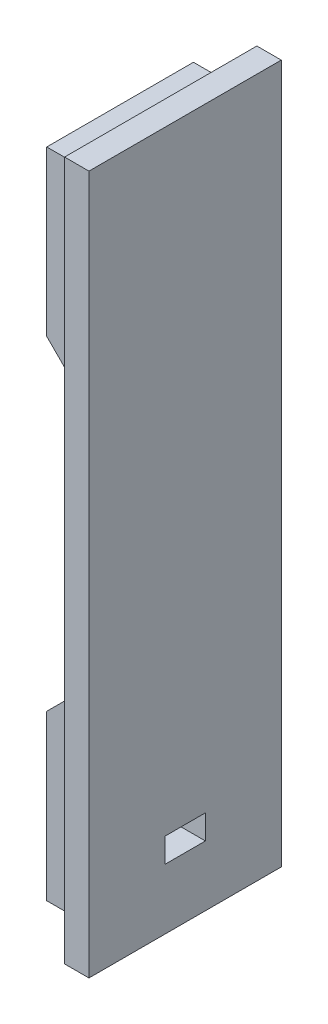
from build123d import *

# Parameters (mm, degrees)
SKETCH1_W               = 23.666666666
SKETCH1_H               = 86
BOSS_EXTRUDE1_DEPTH     = 3
SKETCH2_W               = 5
SKETCH2_H               = 3
CUT_EXTRUDE1_DEPTH      = 45.699303997
SKETCH3_W               = 18.054262684
SKETCH3_H               = 80.34146894
BOSS_EXTRUDE2_DEPTH     = 5
SKETCH5_W               = 11.91581337
SKETCH5_H               = 76.008445896
CUT_EXTRUDE2_DEPTH      = 5
CUT_EXTRUDE3_DEPTH      = 45.877920827
CUT_EXTRUDE3_DEPTH_BACK = 45.877920827
SKETCH7_W               = 2
SKETCH7_H               = 9
BOSS_EXTRUDE3_DEPTH     = 5
CUT_EXTRUDE4_DEPTH      = 5
SKETCH9_W               = 2.534423144
SKETCH9_H               = 2
CUT_EXTRUDE5_DEPTH      = 1
CUT_EXTRUDE6_DEPTH      = 2
BOSS_EXTRUDE5_DEPTH     = 2
BOSS_EXTRUDE6_DEPTH     = 2
CUT_EXTRUDE7_START      = -2
CUT_EXTRUDE7_DEPTH      = 2


with BuildPart() as part:
    # Sketch1 → Boss-Extrude1 (new body)
    with BuildSketch(Plane(origin=(0, 0, 0), x_dir=(0, 0, -1), z_dir=(1, 0, 0))):
        Rectangle(SKETCH1_W, SKETCH1_H)
    extrude(amount=BOSS_EXTRUDE1_DEPTH)

    # Sketch2 → Cut-Extrude1 (cut, through all)
    with BuildSketch(Plane(origin=(3, 0, 0), x_dir=(0, 0, -1), z_dir=(1, 0, 0))):
        with Locations((0, -34.060962647)):
            Rectangle(SKETCH2_W, SKETCH2_H)
    extrude(amount=-CUT_EXTRUDE1_DEPTH, mode=Mode.SUBTRACT)

    # Sketch3 → Boss-Extrude2 (add)
    with BuildSketch(Plane.ZY):
        Rectangle(SKETCH3_W, SKETCH3_H)
    extrude(amount=BOSS_EXTRUDE2_DEPTH)

    # Sketch5 → Cut-Extrude2 (cut)
    with BuildSketch(Plane.ZY.offset(5)):
        Rectangle(SKETCH5_W, SKETCH5_H)
    extrude(amount=-CUT_EXTRUDE2_DEPTH, mode=Mode.SUBTRACT)

    # Sketch6 → Cut-Extrude3 (cut, two sides: drawn at the far end of the back side and taken through both)
    with BuildSketch(Plane.XY.offset(-CUT_EXTRUDE3_DEPTH_BACK)):
        Polygon((-5, -19.974207963), (-1.714874455, -16.689082418), (-1.714874455, 16.689082418), (-5, 19.974207963), align=None)
    extrude(amount=CUT_EXTRUDE3_DEPTH + CUT_EXTRUDE3_DEPTH_BACK, mode=Mode.SUBTRACT)

    # Sketch7 → Boss-Extrude3 (add)
    with BuildSketch(Plane.ZY):
        Rectangle(SKETCH7_W, SKETCH7_H)
    extrude(amount=BOSS_EXTRUDE3_DEPTH)

    # Sketch8 → Cut-Extrude4 (cut)
    with BuildSketch(Plane.XY.offset(1)):
        with BuildLine():
            ThreePointArc((-5, -0.459578833), (-2.44210099, -2.530530169), (0, -0.32421434))
            Line((0, -0.32421434), (0, 0.32421434))
            ThreePointArc((0, 0.32421434), (-2.44210099, 2.530530169), (-5, 0.459578833))
            Line((-5, 0.459578833), (-5, -0.459578833))
        make_face()
        with BuildLine():
            Line((-5, -4.5), (-2.510609776, -4.5))
            ThreePointArc((-2.510609776, -4.5), (-3.81075192, -4.308088951), (-5, -3.748724625))
            Line((-5, -3.748724625), (-5, -4.5))
        make_face()
        with BuildLine():
            Line((-2.510609776, -4.5), (0, -4.5))
            Line((0, -4.5), (0, -3.734546632))
            ThreePointArc((0, -3.734546632), (-1.198256898, -4.304384965), (-2.510609776, -4.5))
        make_face()
        with BuildLine():
            ThreePointArc((-2.510609794, 4.5), (-1.198256907, 4.304384967), (0, 3.734546632))
            Line((0, 3.734546632), (0, 4.5))
            Line((0, 4.5), (-2.510609794, 4.5))
        make_face()
        with BuildLine():
            ThreePointArc((-5, 3.748724625), (-3.810751929, 4.308088948), (-2.510609794, 4.5))
            Line((-2.510609794, 4.5), (-5, 4.5))
            Line((-5, 4.5), (-5, 3.748724625))
        make_face()
    extrude(amount=-CUT_EXTRUDE4_DEPTH, mode=Mode.SUBTRACT)

    # Sketch9 → Cut-Extrude5 (cut)
    with BuildSketch(Plane.ZY.offset(5)):
        Rectangle(SKETCH9_W, SKETCH9_H)
    extrude(amount=-CUT_EXTRUDE5_DEPTH, mode=Mode.SUBTRACT)

    # Sketch12 → Cut-Extrude6 (cut)
    with BuildSketch(Plane.XY.offset(1)):
        with BuildLine():
            Line((-4.836179898, -1), (-5, -1))
            Line((-5, -1), (-5, -3.748724625))
            ThreePointArc((-5, -3.748724625), (-2.497849634, -4.499981909), (0, -3.734546632))
            Line((0, -3.734546632), (0, -0.32421434))
            ThreePointArc((0, -0.32421434), (-2.160279243, -2.507098902), (-4.836179898, -1))
        make_face()
        with BuildLine():
            Line((-5, 3.748724625), (-5, 1))
            Line((-5, 1), (-4.836179898, 1))
            ThreePointArc((-4.836179898, 1), (-2.160279243, 2.507098902), (0, 0.32421434))
            Line((0, 0.32421434), (0, 3.734546632))
            ThreePointArc((0, 3.734546632), (-2.497849634, 4.499981909), (-5, 3.748724625))
        make_face()
    extrude(amount=-CUT_EXTRUDE6_DEPTH, mode=Mode.SUBTRACT)

    # Sketch10 → Boss-Extrude5 (add)
    with BuildSketch(Plane.XY.offset(1)):
        with BuildLine():
            Line((0.632034053, -1.144834058), (-0.193, -4.453864907))
            ThreePointArc((-0.193, -4.453864907), (-2.801828378, -4.592278965), (-5.047908598, -3.258012274))
            Line((-5.047908598, -3.258012274), (-4.41989103, -0.739171385))
            Line((-4.41989103, -0.739171385), (-4.335953587, -0.66680401))
            ThreePointArc((-4.335953587, -0.66680401), (-2.053682052, -3.002243354), (0.632034053, -1.144834058))
        make_face()
        with BuildLine():
            Line((-5.047908598, 3.258012274), (-4.41989103, 0.739171385))
            Line((-4.41989103, 0.739171385), (-4.335953587, 0.66680401))
            ThreePointArc((-4.335953587, 0.66680401), (-2.053682052, 3.002243354), (0.632034053, 1.144834058))
            Line((0.632034053, 1.144834058), (-0.193, 4.453864907))
            ThreePointArc((-0.193, 4.453864907), (-2.801828378, 4.592278965), (-5.047908598, 3.258012274))
        make_face()
    extrude(amount=-BOSS_EXTRUDE5_DEPTH)

    # Sketch13 → Boss-Extrude6 (add)
    with BuildSketch(Plane(origin=(0, 0, -1), x_dir=(-1, 0, 0), z_dir=(0, 0, -1))):
        Polygon((0, 3.679784186), (0.193, 4.453864907), (-0.617433114, 4.244828064), (-0.739085506, -4.079345447), (0.193, -4.453864907), (0, -3.679784186), (0, -2.250971384), (0, 2.250971384), align=None)
    extrude(amount=-BOSS_EXTRUDE6_DEPTH)

    # Sketch15 → Cut-Extrude7 (cut)
    with BuildSketch(Plane(origin=(0, 0, -1), x_dir=(-1, 0, 0), z_dir=(0, 0, -1)).offset(CUT_EXTRUDE7_START)):
        Polygon((4.65583066, 1.685473556), (5.047908598, 3.258012274), (4.038538563, 1.685473556), align=None)
        with BuildLine():
            Line((4.65583066, 1.685473556), (4.038538563, 1.685473556))
            ThreePointArc((4.038538563, 1.685473556), (4.241224486, 1.191898546), (4.335953587, 0.66680401))
            Line((4.335953587, 0.66680401), (4.41989103, 0.739171385))
            Line((4.41989103, 0.739171385), (4.65583066, 1.685473556))
        make_face()
        with BuildLine():
            ThreePointArc((4.335953587, -0.66680401), (4.241224486, -1.191898546), (4.038538563, -1.685473556))
            Line((4.038538563, -1.685473556), (4.65583066, -1.685473556))
            Line((4.65583066, -1.685473556), (4.41989103, -0.739171385))
            Line((4.41989103, -0.739171385), (4.335953587, -0.66680401))
        make_face()
        Polygon((4.65583066, -1.685473556), (4.038538563, -1.685473556), (5.047908598, -3.258012274), align=None)
    extrude(amount=CUT_EXTRUDE7_DEPTH, mode=Mode.SUBTRACT)


solid = part.part
